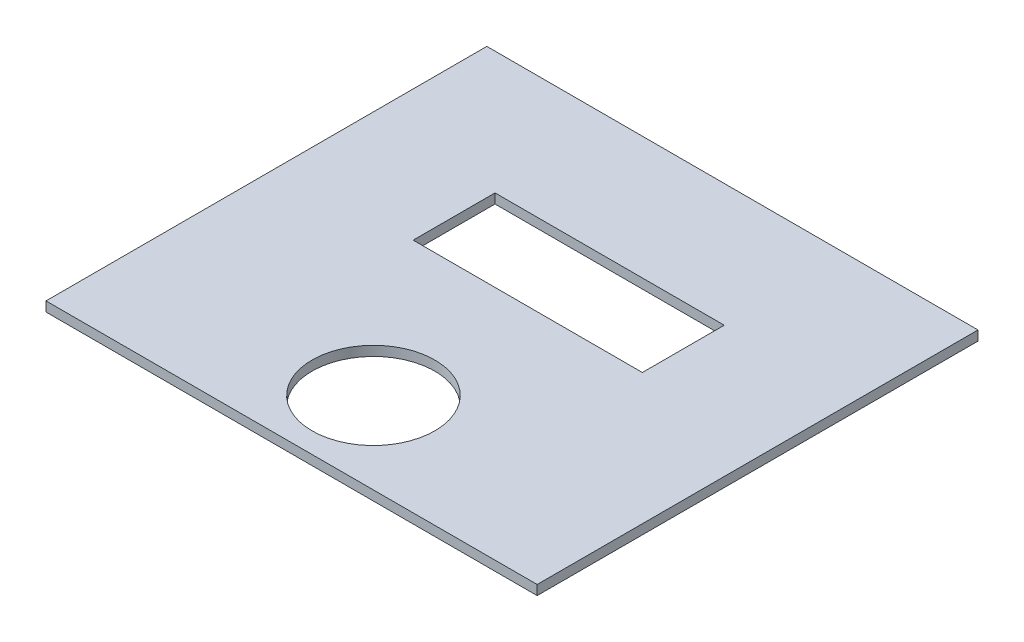
from build123d import *

# Parameters (mm, degrees)
SKETCH1_W           = 152.4
SKETCH1_H           = 136.78408
SKETCH1_R           = 19.05
SKETCH1_W_2         = 71.12
SKETCH1_H_2         = 25.4
BOSS_EXTRUDE1_DEPTH = 3


with BuildPart() as part:
    # Sketch1 → Boss-Extrude1 (new body)
    with BuildSketch(Plane(origin=(0, 0, 0), x_dir=(1, 0, 0), z_dir=(0, 1, 0))):
        Rectangle(SKETCH1_W, SKETCH1_H)
        with Locations(Location((0, -42.99204, 0), (0, 0, 270))):
            Circle(SKETCH1_R, mode=Mode.SUBTRACT)
        with Locations((0, 17.59204)):
            Rectangle(SKETCH1_W_2, SKETCH1_H_2, mode=Mode.SUBTRACT)
    extrude(amount=BOSS_EXTRUDE1_DEPTH)


solid = part.part
